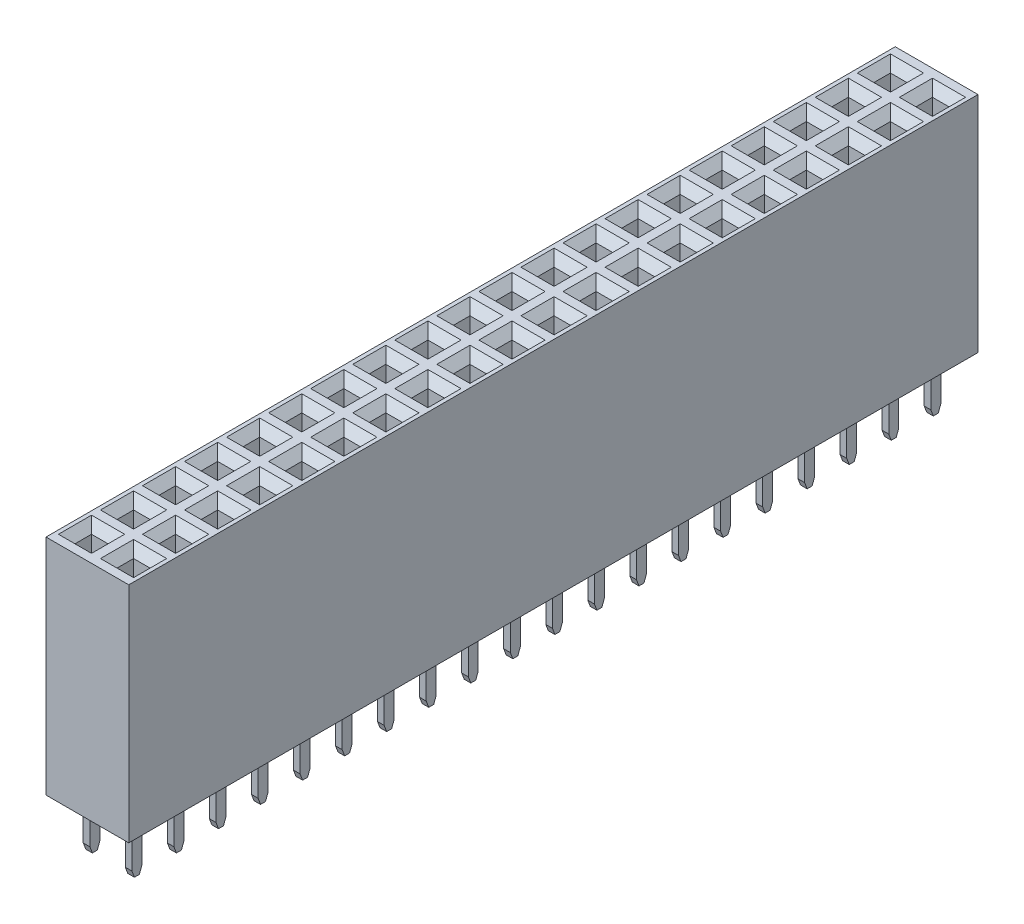
from build123d import *

# Parameters (mm, degrees)
SKETCH_1_W                         = 5
SKETCH_1_H                         = 13.5
EXTRUDE_1_DEPTH                    = 25.65
SKETCH_2_W                         = 1
SKETCH_2_H                         = 1
CUT_EXTRUDE_1_DEPTH                = 13.5
CHAMFER_1_SIZE                     = 0.5
PATTERN_LINEAR_1_COUNT             = 20
PATTERN_LINEAR_1_PITCH             = 2.54
PATTERN_LINEAR_1_COUNT_DIR2        = 2
PATTERN_LINEAR_1_PITCH_DIR2        = 2.54
CHAMFER_1_OF_PATTERN_LINEAR_1_SIZE = 0.5
EXTRUDE_2_DEPTH                    = 0.2
PATTERN_LINEAR_2_COUNT             = 20
PATTERN_LINEAR_2_PITCH             = 2.54
PATTERN_LINEAR_2_COUNT_DIR2        = 2
PATTERN_LINEAR_2_PITCH_DIR2        = 2.54


with BuildPart() as part:
    # Эскиз1 → Бобышка-Вытянуть1 (new, symmetric)
    with BuildSketch(Plane.XY):
        with Locations((0, 6.75)):
            Rectangle(SKETCH_1_W, SKETCH_1_H)
    extrude(amount=EXTRUDE_1_DEPTH, both=True)

    # Эскиз2 → Вырез-Вытянуть1 (cut)
    with BuildSketch(Plane(origin=(0, 13.5, 0), x_dir=(1, 0, 0), z_dir=(0, 1, 0))):
        with Locations((-1.27, -24.13)):
            Rectangle(SKETCH_2_W, SKETCH_2_H)
    cut_extrude_1 = extrude(amount=-CUT_EXTRUDE_1_DEPTH, mode=Mode.SUBTRACT)

    # Фаска1
    chamfer_1_edges = [part.edges().sort_by_distance(p)[0] for p in [
        (-1.77, 13.5, 24.13),
        (-1.27, 13.5, 24.63),
        (-0.77, 13.5, 24.13),
        (-1.27, 13.5, 23.63),
    ]]
    chamfer(chamfer_1_edges, length=CHAMFER_1_SIZE)

    # Линейный массив1: Cut-Extrude 1 20 × 2
    with Locations(*[(j * PATTERN_LINEAR_1_PITCH_DIR2, 0, -i * PATTERN_LINEAR_1_PITCH) for i in range(PATTERN_LINEAR_1_COUNT) for j in range(PATTERN_LINEAR_1_COUNT_DIR2) if (i, j) != (0, 0)]):
        add(cut_extrude_1, mode=Mode.SUBTRACT)

    # Фаска1 of Линейный массив1
    chamfer_1_of_pattern_linear_1_edges = [part.edges().sort_by_distance(p)[0] for p in [
        (0.77, 13.5, 24.13),
        (1.27, 13.5, 24.63),
        (1.77, 13.5, 24.13),
        (1.27, 13.5, 23.63),
        (-1.77, 13.5, 21.59),
        (-1.27, 13.5, 22.09),
        (-0.77, 13.5, 21.59),
        (-1.27, 13.5, 21.09),
        (0.77, 13.5, 21.59),
        (1.27, 13.5, 22.09),
        (1.77, 13.5, 21.59),
        (1.27, 13.5, 21.09),
        (-1.77, 13.5, 19.05),
        (-1.27, 13.5, 19.55),
        (-0.77, 13.5, 19.05),
        (-1.27, 13.5, 18.55),
        (0.77, 13.5, 19.05),
        (1.27, 13.5, 19.55),
        (1.77, 13.5, 19.05),
        (1.27, 13.5, 18.55),
        (-1.77, 13.5, 16.51),
        (-1.27, 13.5, 17.01),
        (-0.77, 13.5, 16.51),
        (-1.27, 13.5, 16.01),
        (0.77, 13.5, 16.51),
        (1.27, 13.5, 17.01),
        (1.77, 13.5, 16.51),
        (1.27, 13.5, 16.01),
        (-1.77, 13.5, 13.97),
        (-1.27, 13.5, 14.47),
        (-0.77, 13.5, 13.97),
        (-1.27, 13.5, 13.47),
        (0.77, 13.5, 13.97),
        (1.27, 13.5, 14.47),
        (1.77, 13.5, 13.97),
        (1.27, 13.5, 13.47),
        (-1.77, 13.5, 11.43),
        (-1.27, 13.5, 11.93),
        (-0.77, 13.5, 11.43),
        (-1.27, 13.5, 10.93),
        (0.77, 13.5, 11.43),
        (1.27, 13.5, 11.93),
        (1.77, 13.5, 11.43),
        (1.27, 13.5, 10.93),
        (-1.77, 13.5, 8.89),
        (-1.27, 13.5, 9.39),
        (-0.77, 13.5, 8.89),
        (-1.27, 13.5, 8.39),
        (0.77, 13.5, 8.89),
        (1.27, 13.5, 9.39),
        (1.77, 13.5, 8.89),
        (1.27, 13.5, 8.39),
        (-1.77, 13.5, 6.35),
        (-1.27, 13.5, 6.85),
        (-0.77, 13.5, 6.35),
        (-1.27, 13.5, 5.85),
        (0.77, 13.5, 6.35),
        (1.27, 13.5, 6.85),
        (1.77, 13.5, 6.35),
        (1.27, 13.5, 5.85),
        (-1.77, 13.5, 3.81),
        (-1.27, 13.5, 4.31),
        (-0.77, 13.5, 3.81),
        (-1.27, 13.5, 3.31),
        (0.77, 13.5, 3.81),
        (1.27, 13.5, 4.31),
        (1.77, 13.5, 3.81),
        (1.27, 13.5, 3.31),
        (-1.77, 13.5, 1.27),
        (-1.27, 13.5, 1.77),
        (-0.77, 13.5, 1.27),
        (-1.27, 13.5, 0.77),
        (0.77, 13.5, 1.27),
        (1.27, 13.5, 1.77),
        (1.77, 13.5, 1.27),
        (1.27, 13.5, 0.77),
        (-1.77, 13.5, -1.27),
        (-1.27, 13.5, -0.77),
        (-0.77, 13.5, -1.27),
        (-1.27, 13.5, -1.77),
        (0.77, 13.5, -1.27),
        (1.27, 13.5, -0.77),
        (1.77, 13.5, -1.27),
        (1.27, 13.5, -1.77),
        (-1.77, 13.5, -3.81),
        (-1.27, 13.5, -3.31),
        (-0.77, 13.5, -3.81),
        (-1.27, 13.5, -4.31),
        (0.77, 13.5, -3.81),
        (1.27, 13.5, -3.31),
        (1.77, 13.5, -3.81),
        (1.27, 13.5, -4.31),
        (-1.77, 13.5, -6.35),
        (-1.27, 13.5, -5.85),
        (-0.77, 13.5, -6.35),
        (-1.27, 13.5, -6.85),
        (0.77, 13.5, -6.35),
        (1.27, 13.5, -5.85),
        (1.77, 13.5, -6.35),
        (1.27, 13.5, -6.85),
        (-1.77, 13.5, -8.89),
        (-1.27, 13.5, -8.39),
        (-0.77, 13.5, -8.89),
        (-1.27, 13.5, -9.39),
        (0.77, 13.5, -8.89),
        (1.27, 13.5, -8.39),
        (1.77, 13.5, -8.89),
        (1.27, 13.5, -9.39),
        (-1.77, 13.5, -11.43),
        (-1.27, 13.5, -10.93),
        (-0.77, 13.5, -11.43),
        (-1.27, 13.5, -11.93),
        (0.77, 13.5, -11.43),
        (1.27, 13.5, -10.93),
        (1.77, 13.5, -11.43),
        (1.27, 13.5, -11.93),
        (-1.77, 13.5, -13.97),
        (-1.27, 13.5, -13.47),
        (-0.77, 13.5, -13.97),
        (-1.27, 13.5, -14.47),
        (0.77, 13.5, -13.97),
        (1.27, 13.5, -13.47),
        (1.77, 13.5, -13.97),
        (1.27, 13.5, -14.47),
        (-1.77, 13.5, -16.51),
        (-1.27, 13.5, -16.01),
        (-0.77, 13.5, -16.51),
        (-1.27, 13.5, -17.01),
        (0.77, 13.5, -16.51),
        (1.27, 13.5, -16.01),
        (1.77, 13.5, -16.51),
        (1.27, 13.5, -17.01),
        (-1.77, 13.5, -19.05),
        (-1.27, 13.5, -18.55),
        (-0.77, 13.5, -19.05),
        (-1.27, 13.5, -19.55),
        (0.77, 13.5, -19.05),
        (1.27, 13.5, -18.55),
        (1.77, 13.5, -19.05),
        (1.27, 13.5, -19.55),
        (-1.77, 13.5, -21.59),
        (-1.27, 13.5, -21.09),
        (-0.77, 13.5, -21.59),
        (-1.27, 13.5, -22.09),
        (0.77, 13.5, -21.59),
        (1.27, 13.5, -21.09),
        (1.77, 13.5, -21.59),
        (1.27, 13.5, -22.09),
        (-1.77, 13.5, -24.13),
        (-1.27, 13.5, -23.63),
        (-0.77, 13.5, -24.13),
        (-1.27, 13.5, -24.63),
        (0.77, 13.5, -24.13),
        (1.27, 13.5, -23.63),
        (1.77, 13.5, -24.13),
        (1.27, 13.5, -24.63),
    ]]
    chamfer(chamfer_1_of_pattern_linear_1_edges, length=CHAMFER_1_OF_PATTERN_LINEAR_1_SIZE)


with BuildPart() as body_2:
    # Эскиз3 → Бобышка-Вытянуть2 (new, symmetric)
    with BuildSketch(Plane(origin=(-1.27, 0, 0), x_dir=(0, 0, -1), z_dir=(1, 0, 0))):
        Polygon((-23.83, 2), (-23.83, -2.6), (-23.98, -3), (-24.28, -3), (-24.43, -2.6), (-24.43, 2), align=None)
    extrude_2 = extrude(amount=EXTRUDE_2_DEPTH, both=True)


with BuildPart() as pattern_linear_2_1:
    # Линейный массив2: Extrude 2 20 × 2
    with Locations(*[(j * PATTERN_LINEAR_2_PITCH_DIR2, 0, -i * PATTERN_LINEAR_2_PITCH) for i in range(PATTERN_LINEAR_2_COUNT) for j in range(PATTERN_LINEAR_2_COUNT_DIR2) if (i, j) != (0, 0)]):
        add(extrude_2)


solid = Compound([part.part, body_2.part, pattern_linear_2_1.part])
